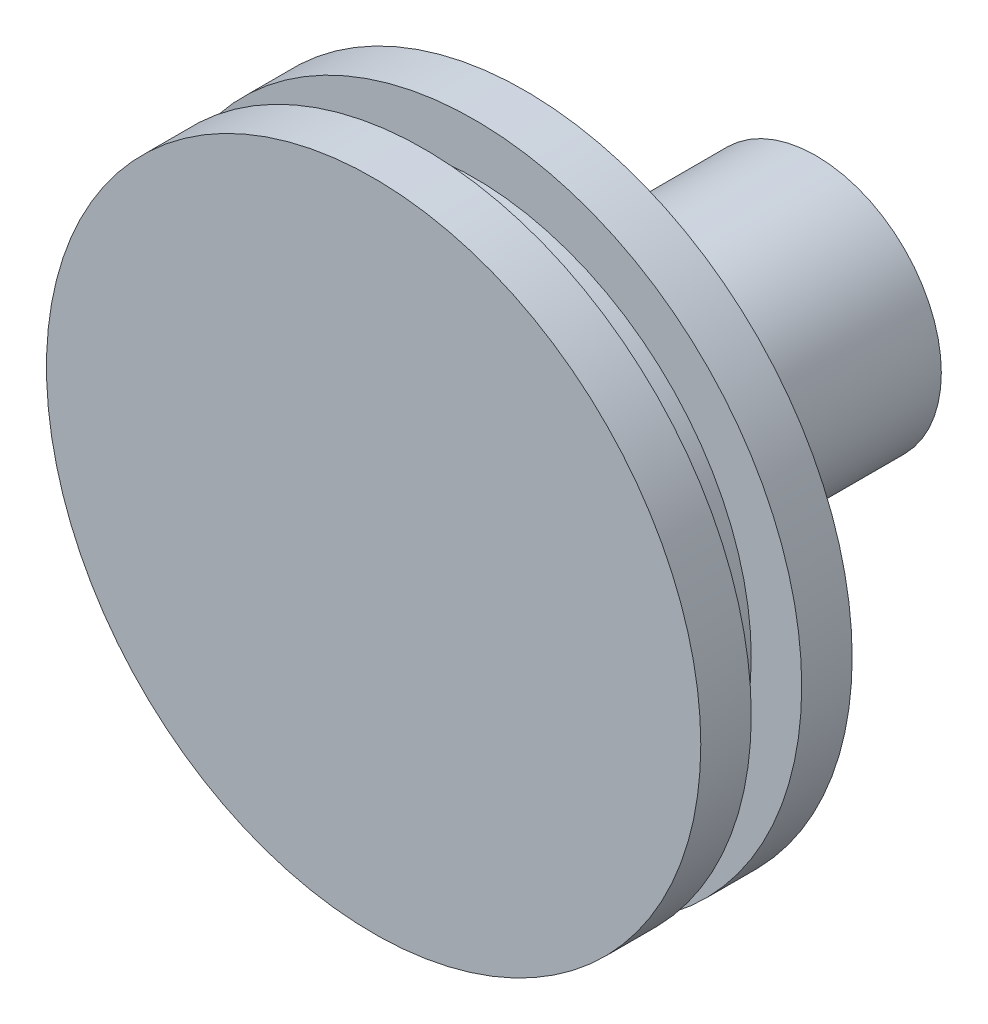
from build123d import *

# Parameters (mm, degrees)
SKETCH1_R           = 3.725
BOSS_EXTRUDE1_DEPTH = 8.65
SKETCH2_R           = 9.725
BOSS_EXTRUDE2_DEPTH = 1.5
SKETCH3_R           = 8.225
BOSS_EXTRUDE3_DEPTH = 1.5
SKETCH5_R           = 9.725
BOSS_EXTRUDE5_DEPTH = 1.5


with BuildPart() as part:
    # Sketch1 → Boss-Extrude1 (new body)
    with BuildSketch(Plane.XY):
        with Locations(Location((0, 0, 0), (0, 0, 270))):
            Circle(SKETCH1_R)
        with BuildLine():
            Line((-1.886796226, -1.825), (1.886796226, -1.825))
            ThreePointArc((1.886796226, -1.825), (2.625, 0), (1.886796226, 1.825))
            Line((1.886796226, 1.825), (-1.886796226, 1.825))
            ThreePointArc((-1.886796226, 1.825), (-2.625, 0), (-1.886796226, -1.825))
        make_face(mode=Mode.SUBTRACT)
    extrude(amount=BOSS_EXTRUDE1_DEPTH)

    # Sketch2 → Boss-Extrude2 (add)
    with BuildSketch(Plane.XY.offset(8.65)):
        Circle(SKETCH2_R)
    extrude(amount=BOSS_EXTRUDE2_DEPTH)

    # Sketch3 → Boss-Extrude3 (add)
    with BuildSketch(Plane.XY.offset(10.15)):
        Circle(SKETCH3_R)
    extrude(amount=BOSS_EXTRUDE3_DEPTH)

    # Sketch5 → Boss-Extrude5 (add)
    with BuildSketch(Plane.XY.offset(11.65)):
        Circle(SKETCH5_R)
    extrude(amount=BOSS_EXTRUDE5_DEPTH)


solid = part.part
